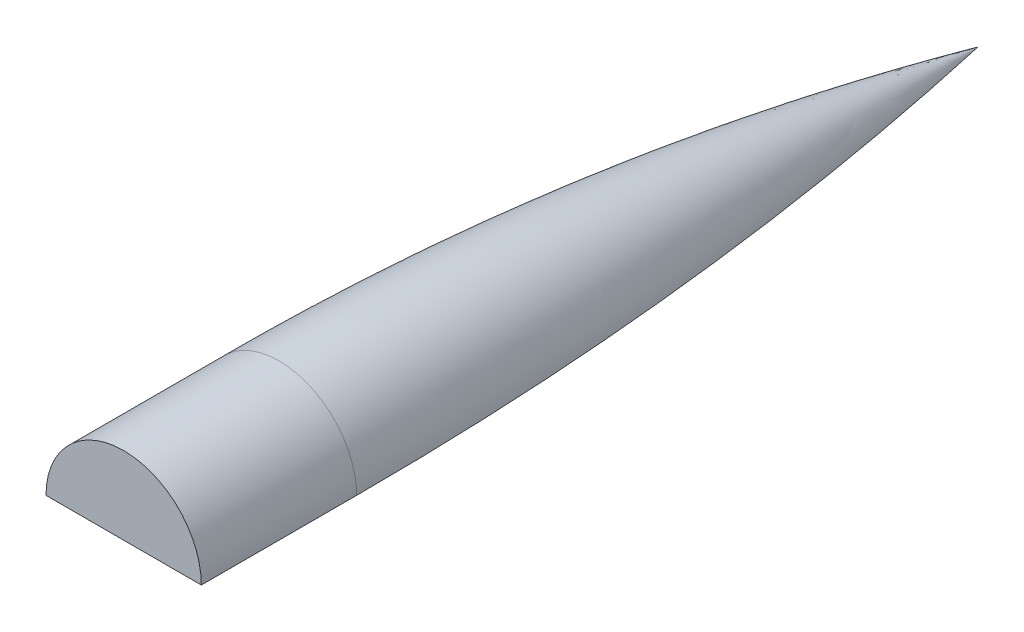
from build123d import *

# Parameters (mm, degrees)
SKETCH1_W      = 76.2
SKETCH1_H      = 152.4
REVOLVE1_ANGLE = 180


with BuildPart() as part:
    # Sketch1 → Revolve1 (revolve)
    with BuildSketch(Plane(origin=(0, 0, 0), x_dir=(1, 0, 0), z_dir=(0, 1, 0))):
        with Locations((-38.1, -76.2)):
            Rectangle(SKETCH1_W, SKETCH1_H)
        with BuildLine():
            Line((0, 685.8), (0, 0))
            Line((0, 0), (-76.2, 0))
            ThreePointArc((-76.2, 0), (-57.091563867, 345.010173763), (0, 685.8))
        make_face()
    revolve(axis=Axis((0, 0, 0), (0, 0, -1)), revolution_arc=REVOLVE1_ANGLE)


solid = part.part
